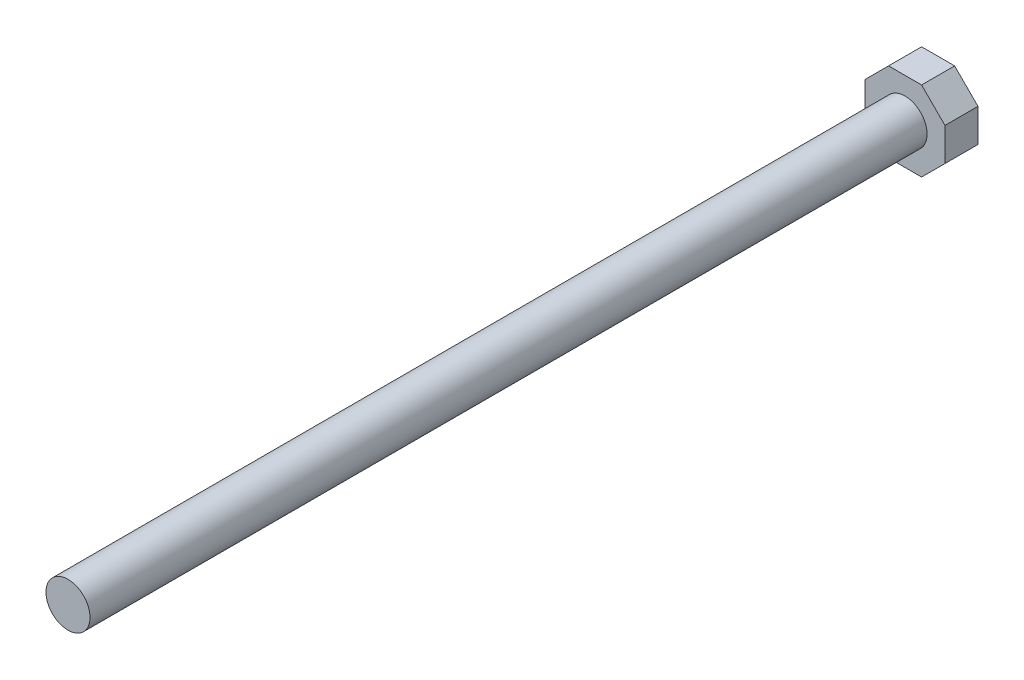
from build123d import *

# Parameters (mm, degrees)
AUFSATZ_LINEAR_AUSTRAGEN1_DEPTH = 3
SKIZZE2_R                       = 2
AUFSATZ_LINEAR_AUSTRAGEN2_DEPTH = 76


with BuildPart() as part:
    # Skizze1 → Aufsatz-Linear austragen1 (new body)
    with BuildSketch(Plane.XY):
        Polygon((-1.777039873, 0.285182154), (0.34428047, 2.406502498), (3.34428047, 2.406502498), (5.465600814, 0.285182154), (5.465600814, -2.714817846), (3.34428047, -4.83613819), (0.34428047, -4.83613819), (-1.777039873, -2.714817846), align=None)
    extrude(amount=AUFSATZ_LINEAR_AUSTRAGEN1_DEPTH)

    # Skizze2 → Aufsatz-Linear austragen2 (add)
    with BuildSketch(Plane.XY.offset(3)):
        with Locations((1.84428047, -1.214817846)):
            Circle(SKIZZE2_R)
    extrude(amount=AUFSATZ_LINEAR_AUSTRAGEN2_DEPTH)


solid = part.part
